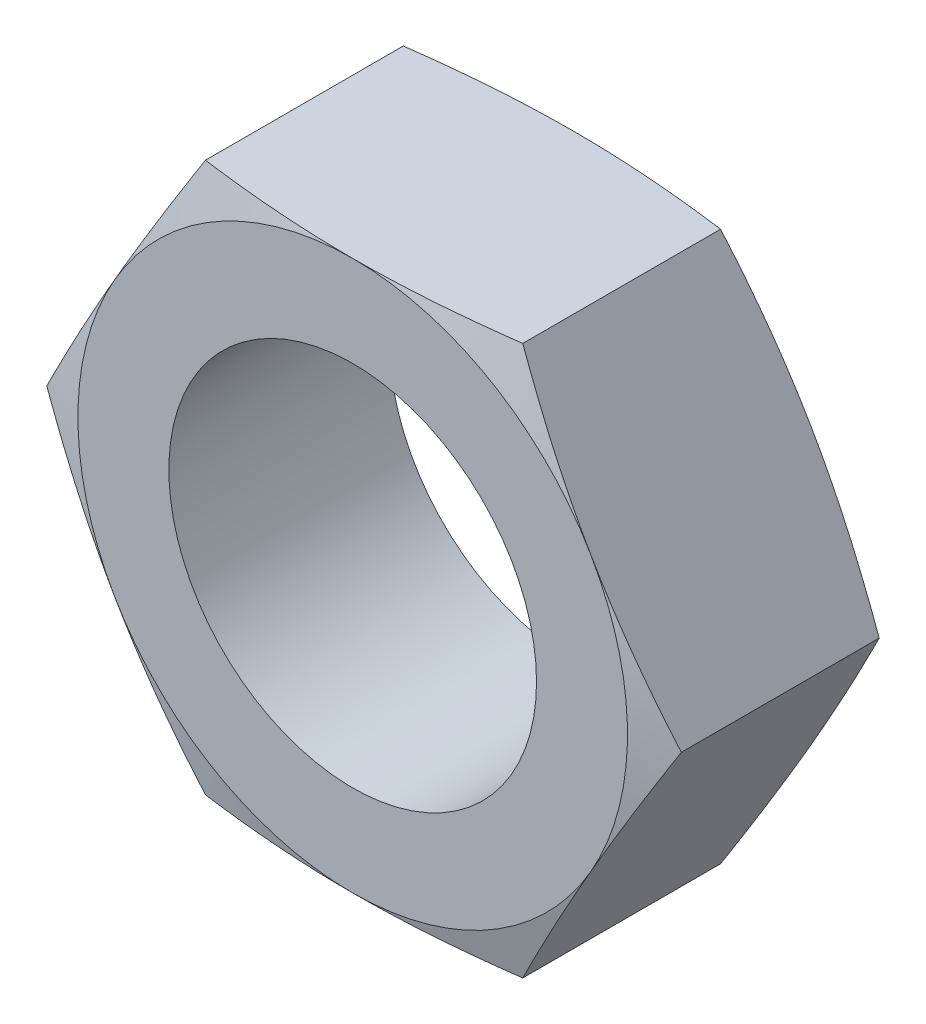
from build123d import *

# Parameters (mm, degrees)
SKETCH_1_R          = 2.5
EXTRUDE_514_DEPTH   = 3
SKETCH_2_OUTSIDE_W  = 296.626
SKETCH_2_OUTSIDE_H  = 295.47
SKETCH_2_OUTSIDE_R  = 3.736899617
CUT_EXTRUDE_1_DEPTH = 38
CUT_EXTRUDE_1_DRAFT = -75
SKETCH_3_OUTSIDE_W  = 296.626
SKETCH_3_OUTSIDE_H  = 295.47
SKETCH_3_OUTSIDE_R  = 3.736899617
CUT_EXTRUDE_2_DEPTH = 38
CUT_EXTRUDE_2_DRAFT = -75


with BuildPart() as part:
    # 草图1 → Extrude 514 (new body)
    with BuildSketch(Plane.XY):
        Polygon((2.1575, 3.736899617), (-2.1575, 3.736899617), (-4.315, 0), (-2.1575, -3.736899617), (2.1575, -3.736899617), (4.315, 0), align=None)
        Circle(SKETCH_1_R, mode=Mode.SUBTRACT)
    extrude(amount=EXTRUDE_514_DEPTH)


with BuildPart() as cut_extrude_1_tool:
    # 草图2 outside → 切除-拉伸1 (with draft: the straight prism first)
    with BuildSketch(Plane(origin=(0, 0, 0), x_dir=(-1, 0, 0), z_dir=(0, 0, -1))):
        Rectangle(SKETCH_2_OUTSIDE_W, SKETCH_2_OUTSIDE_H)
        Circle(SKETCH_2_OUTSIDE_R, mode=Mode.SUBTRACT)
    extrude(amount=-CUT_EXTRUDE_1_DEPTH)
    # 切除-拉伸1: the draft: its side faces are tilted about the plane it starts from
    cut_extrude_1_sides = [cut_extrude_1_tool.faces().sort_by_distance(p)[0] for p in [
        (0, -147.735, 19),
        (-148.313, 0, 19),
        (0, 147.735, 19),
        (148.313, 0, 19),
        (3.736899617, 0, 19),
    ]]
    draft(cut_extrude_1_sides, Plane(origin=(0, 0, 0), x_dir=(-1, 0, 0), z_dir=(0, 0, -1)), CUT_EXTRUDE_1_DRAFT)


with BuildPart() as part_1:
    add(part.part)

    # 切除-拉伸1: cut by cut_extrude_1_tool
    add(cut_extrude_1_tool.part, mode=Mode.SUBTRACT)


with BuildPart() as cut_extrude_2_tool:
    # 草图3 outside → 切除-拉伸2 (with draft: the straight prism first)
    with BuildSketch(Plane.XY.offset(3)):
        Rectangle(SKETCH_3_OUTSIDE_W, SKETCH_3_OUTSIDE_H)
        Circle(SKETCH_3_OUTSIDE_R, mode=Mode.SUBTRACT)
    extrude(amount=-CUT_EXTRUDE_2_DEPTH)
    # 切除-拉伸2: the draft: its side faces are tilted about the plane it starts from
    cut_extrude_2_sides = [cut_extrude_2_tool.faces().sort_by_distance(p)[0] for p in [
        (0, -147.735, -16),
        (148.313, 0, -16),
        (0, 147.735, -16),
        (-148.313, 0, -16),
        (-3.736899617, 0, -16),
    ]]
    draft(cut_extrude_2_sides, Plane.XY.offset(3), CUT_EXTRUDE_2_DRAFT)


with BuildPart() as part_2:
    add(part_1.part)

    # 切除-拉伸2: cut by cut_extrude_2_tool
    add(cut_extrude_2_tool.part, mode=Mode.SUBTRACT)


solid = part_2.part
